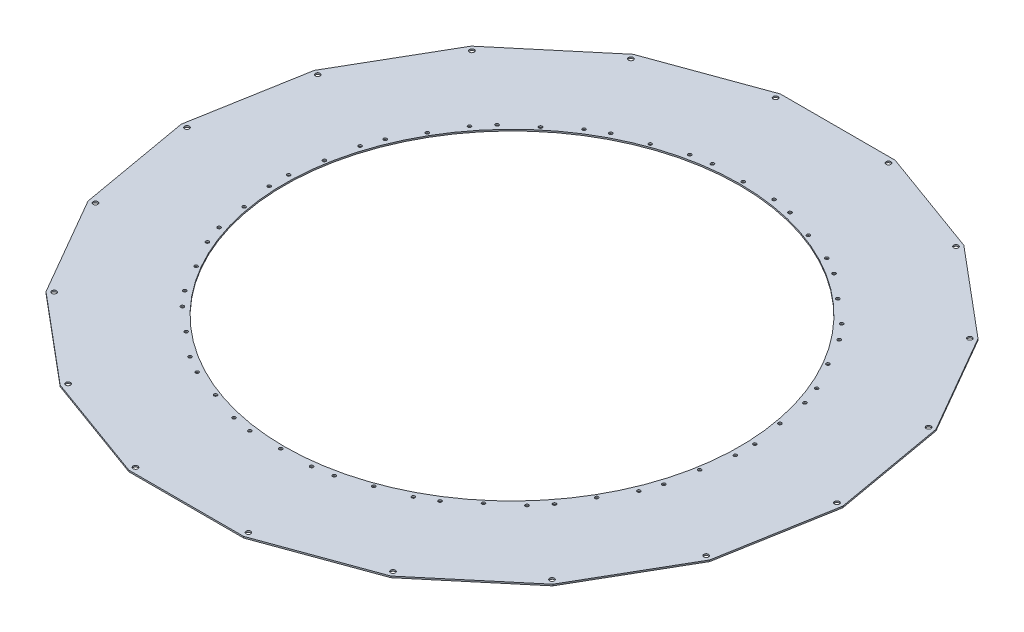
from build123d import *

# Parameters (mm, degrees)
SKETCH1_R                               = 492.125
BOSS_EXTRUDE1_DEPTH                     = 3.175
F_3_8_CLEARANCE_HOLE1_D                 = 10.31748
F_1_4_CLEARANCE_HOLE_FOR_RFOF_D         = 7.14248
CIRPATTERN_18X_MOUNT_HOLES_IN_OUT_COUNT = 18


with BuildPart() as part:
    # Sketch1 → Boss-Extrude1 (new body)
    with BuildSketch(Plane(origin=(0, 0, 0), x_dir=(1, 0, 0), z_dir=(0, 1, 0))):
        Polygon((-715, 0), (-671.880223862, -244.544402478), (-547.72177683, -459.593140926), (-357.5, -619.208163706), (-124.158447032, -704.137543404), (124.158447032, -704.137543404), (357.5, -619.208163706), (547.72177683, -459.593140926), (671.880223862, -244.544402478), (715, 0), (671.880223862, 244.544402478), (547.72177683, 459.593140926), (357.5, 619.208163706), (124.158447032, 704.137543404), (-124.158447032, 704.137543404), (-357.5, 619.208163706), (-547.72177683, 459.593140926), (-671.880223862, 244.544402478), align=None)
        with Locations(Location((0, 0, 0), (0, 0, 270))):
            Circle(SKETCH1_R, mode=Mode.SUBTRACT)
    extrude(amount=BOSS_EXTRUDE1_DEPTH)

    # 3/8 Clearance Hole1 (through all)
    with Locations(Plane(origin=(0, 3.175, 0), x_dir=(1, 0, 0), z_dir=(0, 1, 0))):
        with Locations((-121.987844811, -691.827446491)):
            f_3_8_clearance_hole1 = Hole(F_3_8_CLEARANCE_HOLE1_D / 2)

    # 1/4 Clearance Hole for RFoF (through all)
    with Locations(Plane(origin=(0, 3.175, 0), x_dir=(1, 0, 0), z_dir=(0, 1, 0))):
        with Locations((-66.675, -499.905299908), (66.675, -499.905299908), (0, -499.905299908)):
            f_1_4_clearance_hole_for_rfof = Hole(F_1_4_CLEARANCE_HOLE_FOR_RFOF_D / 2)

    # CirPattern - 18x Mount Holes In_Out: 3/8 Clearance Hole1, 1/4 Clearance Hole for RFoF ×18 about axis
    cirpattern_18x_mount_holes_in_out_axis = Axis((0, 0, 0), (0, 1, 0))
    add([f_3_8_clearance_hole1.rotate(cirpattern_18x_mount_holes_in_out_axis, i * 360 / CIRPATTERN_18X_MOUNT_HOLES_IN_OUT_COUNT) for i in range(1, CIRPATTERN_18X_MOUNT_HOLES_IN_OUT_COUNT)], mode=Mode.SUBTRACT)
    add([f_1_4_clearance_hole_for_rfof.rotate(cirpattern_18x_mount_holes_in_out_axis, i * 360 / CIRPATTERN_18X_MOUNT_HOLES_IN_OUT_COUNT) for i in range(1, CIRPATTERN_18X_MOUNT_HOLES_IN_OUT_COUNT)], mode=Mode.SUBTRACT)


solid = part.part
